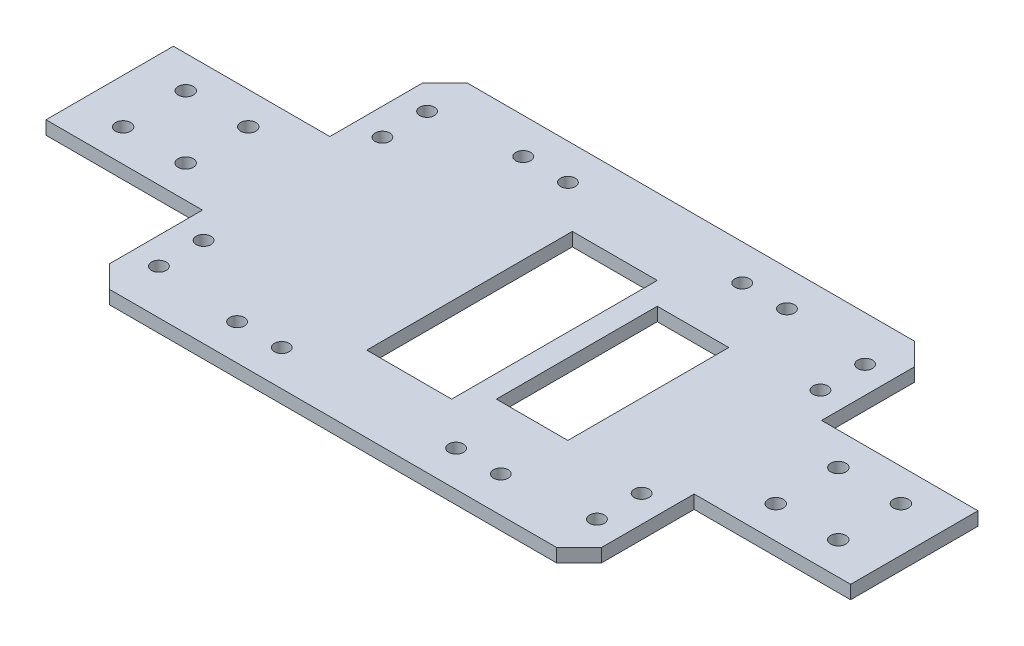
from build123d import *

# Parameters (mm, degrees)
SKETCH1_W           = 19
SKETCH1_H           = 46
SKETCH1_W_2         = 16
SKETCH1_H_2         = 36
SKETCH1_R           = 1.7
BOSS_EXTRUDE1_DEPTH = 3
SKETCH4_R           = 1.65
CUT_EXTRUDE2_DEPTH  = 15
SKETCH5_R           = 1.65
CUT_EXTRUDE3_DEPTH  = 10
CHAMFER1_SIZE       = 5


with BuildPart() as part:
    # Sketch1 → Boss-Extrude1 (new body)
    with BuildSketch(Plane(origin=(0, 0, 0), x_dir=(1, 0, 0), z_dir=(0, 1, 0))):
        Polygon((55, 40), (-55, 40), (-55, 14.25), (-90, 14.25), (-90, -14.25), (-55, -14.25), (-55, -40), (55, -40), (55, -14.25), (90, -14.25), (90, 14.25), (55, 14.25), align=None)
        Rectangle(SKETCH1_W, SKETCH1_H, mode=Mode.SUBTRACT)
        with Locations((22.5, 0)):
            Rectangle(SKETCH1_W_2, SKETCH1_H_2, mode=Mode.SUBTRACT)
        with Locations(Location((-66, 7, 0), (0, 0, 270))):
            Circle(SKETCH1_R, mode=Mode.SUBTRACT)
        with Locations(Location((-66, -7, 0), (0, 0, 270))):
            Circle(SKETCH1_R, mode=Mode.SUBTRACT)
        with Locations(Location((-80, -7, 0), (0, 0, 270))):
            Circle(SKETCH1_R, mode=Mode.SUBTRACT)
        with Locations(Location((-80, 7, 0), (0, 0, 270))):
            Circle(SKETCH1_R, mode=Mode.SUBTRACT)
        with Locations(Location((66, 7, 0), (0, 0, 270))):
            Circle(SKETCH1_R, mode=Mode.SUBTRACT)
        with Locations(Location((80, 7, 0), (0, 0, 270))):
            Circle(SKETCH1_R, mode=Mode.SUBTRACT)
        with Locations(Location((80, -7, 0), (0, 0, 270))):
            Circle(SKETCH1_R, mode=Mode.SUBTRACT)
        with Locations(Location((66, -7, 0), (0, 0, 270))):
            Circle(SKETCH1_R, mode=Mode.SUBTRACT)
    extrude(amount=BOSS_EXTRUDE1_DEPTH)

    # Sketch4 → Cut-Extrude2 (cut)
    with BuildSketch(Plane(origin=(0, 3, 0), x_dir=(1, 0, 0), z_dir=(0, 1, 0))):
        with Locations(Location((29.5, 32, 0), (0, 0, 270))):
            Circle(SKETCH4_R)
        with Locations(Location((19.5, 32, 0), (0, 0, 270))):
            Circle(SKETCH4_R)
        with Locations(Location((19.5, -32, 0), (0, 0, 270))):
            Circle(SKETCH4_R)
        with Locations(Location((29.5, -32, 0), (0, 0, 270))):
            Circle(SKETCH4_R)
        with Locations(Location((-19.5, 32, 0), (0, 0, 270))):
            Circle(SKETCH4_R)
        with Locations(Location((-29.5, 32, 0), (0, 0, 270))):
            Circle(SKETCH4_R)
        with Locations(Location((-29.5, -32, 0), (0, 0, 270))):
            Circle(SKETCH4_R)
        with Locations(Location((-19.5, -32, 0), (0, 0, 270))):
            Circle(SKETCH4_R)
    extrude(amount=-CUT_EXTRUDE2_DEPTH, mode=Mode.SUBTRACT)

    # Sketch5 → Cut-Extrude3 (cut)
    with BuildSketch(Plane(origin=(0, 3, 0), x_dir=(1, 0, 0), z_dir=(0, 1, 0))):
        with Locations(Location((-49, 30, 0), (0, 0, 270))):
            Circle(SKETCH5_R)
        with Locations(Location((-49, -20, 0), (0, 0, 270))):
            Circle(SKETCH5_R)
        with Locations(Location((-49, -30, 0), (0, 0, 270))):
            Circle(SKETCH5_R)
        with Locations(Location((-49, 20, 0), (0, 0, 270))):
            Circle(SKETCH5_R)
        with Locations(Location((49, 20, 0), (0, 0, 270))):
            Circle(SKETCH5_R)
        with Locations(Location((49, -30, 0), (0, 0, 270))):
            Circle(SKETCH5_R)
        with Locations(Location((49, -20, 0), (0, 0, 270))):
            Circle(SKETCH5_R)
        with Locations(Location((49, 30, 0), (0, 0, 270))):
            Circle(SKETCH5_R)
    extrude(amount=-CUT_EXTRUDE3_DEPTH, mode=Mode.SUBTRACT)

    # Chamfer1
    chamfer1_edges = [part.edges().sort_by_distance(p)[0] for p in [
        (55, 1.5, -40),
        (55, 1.5, 40),
        (-55, 1.5, 40),
        (-55, 1.5, -40),
    ]]
    chamfer(chamfer1_edges, length=CHAMFER1_SIZE)


solid = part.part
